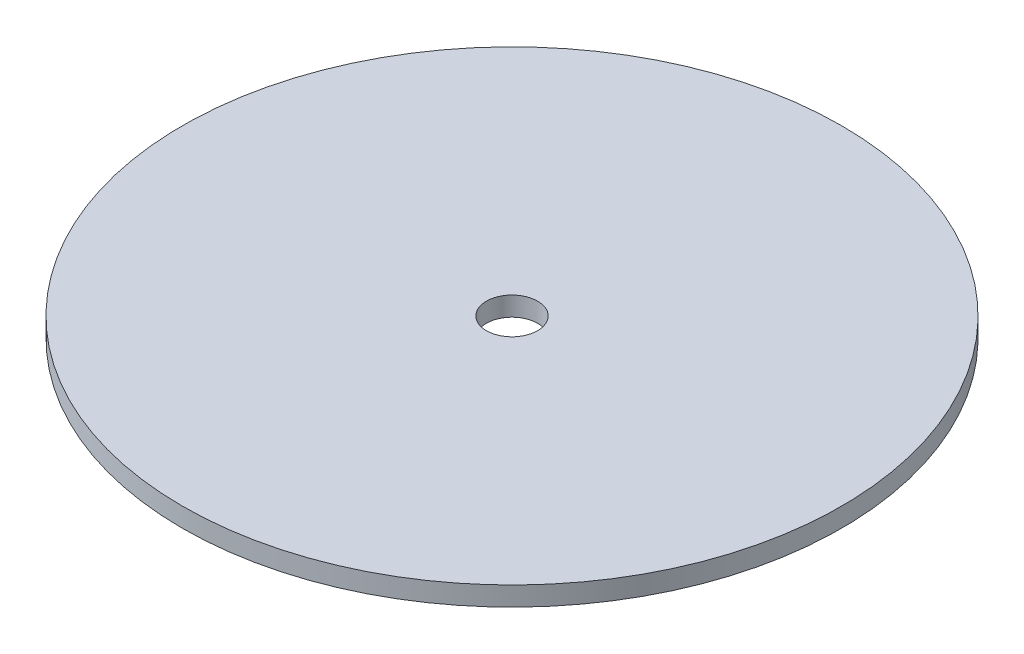
from build123d import *

# Parameters (mm, degrees)
SKETCH1_R      = 10.3
SKETCH1_R_2    = 0.8
EXTRUDE1_DEPTH = 0.6


with BuildPart() as part:
    # Sketch1 → Extrude1 (new body)
    with BuildSketch(Plane(origin=(0, 0, 0), x_dir=(1, 0, 0), z_dir=(0, 1, 0))):
        with Locations(Location((0, 0, 0), (0, 0, 270))):
            Circle(SKETCH1_R)
        with Locations(Location((0, 0, 0), (0, 0, 270))):
            Circle(SKETCH1_R_2, mode=Mode.SUBTRACT)
    extrude(amount=EXTRUDE1_DEPTH)


solid = part.part
